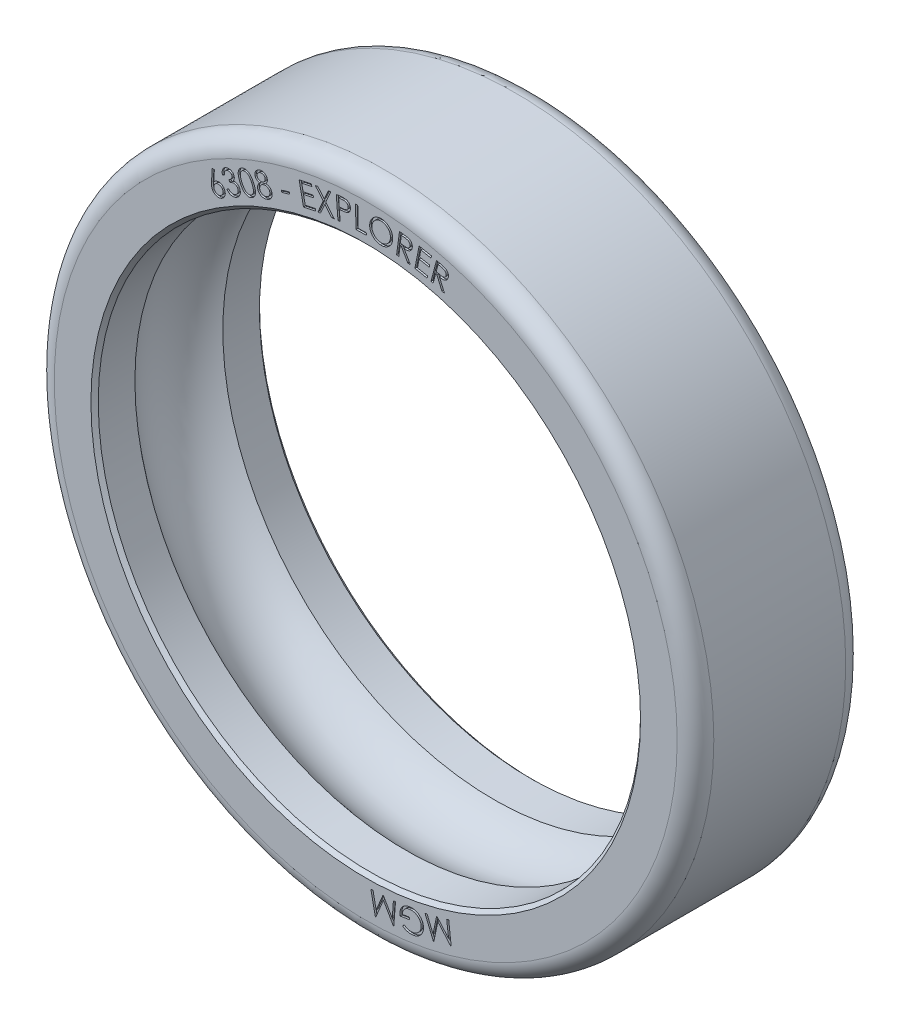
from build123d import *

# Parameters (mm, degrees)
SKETCH1_R           = 45
SKETCH1_R_2         = 37
BOSS_EXTRUDE1_DEPTH = 11.5
FILLET1_R           = 2.5
SKETCH2_R           = 7.5
CHAMFER1_SIZE       = 0.5
CUT_EXTRUDE1_DEPTH  = 0.25


with BuildPart() as part:
    # Sketch1 → Boss-Extrude1 (new, symmetric)
    with BuildSketch(Plane.XY):
        Circle(SKETCH1_R)
        Circle(SKETCH1_R_2, mode=Mode.SUBTRACT)
    extrude(amount=BOSS_EXTRUDE1_DEPTH, both=True)

    # Fillet1
    fillet1_edges = [part.edges().sort_by_distance(p)[0] for p in [
        (-45, 0, -11.5),
        (-45, 0, 11.5),
    ]]
    fillet(fillet1_edges, radius=FILLET1_R)

    # Sketch2 → Cut-Revolve1 (revolve, cut)
    with BuildSketch(Plane(origin=(0, 0, 0), x_dir=(1, 0, 0), z_dir=(0, 1, 0))):
        with Locations((32.5, 0)):
            Circle(SKETCH2_R)
    revolve(axis=Axis((0, 0, 0), (0, 0, -1)), mode=Mode.SUBTRACT)

    # Chamfer1
    chamfer1_edges = [part.edges().sort_by_distance(p)[0] for p in [
        (-37, 0, -11.5),
        (-37, 0, 11.5),
    ]]
    chamfer(chamfer1_edges, length=CHAMFER1_SIZE)

    # Sketch3 → Cut-Extrude1 (cut)
    # profile 1 of 16: a face of its own
    with BuildSketch(Plane.XY.offset(11.5)):
        with BuildLine():
            Line((-20.951800911, 35.882734801), (-20.65853168, 35.870114609))
            Line((-20.65853168, 35.870114609), (-20.724637449, 34.404970378))
            add(Edge.make_bspline(
                [(-20.724637449, 34.404970378), (-20.706102955, 34.425881102), (-20.669986854, 34.466627497), (-20.61218903, 34.521643032), (-20.552536977, 34.568713263), (-20.511103717, 34.595574515), (-20.490863411, 34.608696339)],
                knots=[0, 0, 0, 0, 1.07653288, 2.097719512, 3.070728685, 4, 4, 4, 4], degree=3))
            add(Edge.make_bspline(
                [(-20.490863411, 34.608696339), (-20.465514862, 34.623105222), (-20.415466215, 34.651554387), (-20.33631019, 34.683511799), (-20.256528008, 34.707958378), (-20.175578923, 34.723862726), (-20.093147852, 34.730233452), (-20.009552108, 34.728632328), (-19.924847206, 34.71740187), (-19.840014665, 34.698159049), (-19.756749679, 34.67169782), (-19.677310156, 34.637071504), (-19.602734472, 34.595483881), (-19.532297277, 34.547277424), (-19.467263814, 34.490991004), (-19.40723842, 34.427542669), (-19.351075325, 34.35756211), (-19.319074584, 34.306168089), (-19.302762449, 34.279970378)],
                knots=[0, 0, 0, 0, 1.017777122, 2.009518079, 2.974901327, 3.930286677, 4.885287375, 5.858403718, 6.846358588, 7.865170049, 8.89443432, 9.894366033, 10.88758779, 11.873855289, 12.871408048, 13.886293067, 14.922553973, 16, 16, 16, 16], degree=3))
            add(Edge.make_bspline(
                [(-19.302762449, 34.279970378), (-19.282284248, 34.243208173), (-19.241947782, 34.170796665), (-19.200262331, 34.054988289), (-19.17370131, 33.937268874), (-19.164523221, 33.817954108), (-19.16987247, 33.698775396), (-19.193560108, 33.58166152), (-19.231996368, 33.466989408), (-19.287675732, 33.35712467), (-19.356061588, 33.253847613), (-19.43686923, 33.159983639), (-19.529797926, 33.07756554), (-19.599419343, 33.032327636), (-19.634493218, 33.009537686)],
                knots=[0, 0, 0, 0, 1.033356258, 2.035429699, 3.014277416, 3.992815204, 4.969416816, 5.938397819, 6.921352123, 7.9347311, 8.958046688, 9.960410677, 10.972495764, 12, 12, 12, 12], degree=3))
            add(Edge.make_bspline(
                [(-19.634493218, 33.009537686), (-19.669888882, 32.990127504), (-19.73988882, 32.95174112), (-19.852546956, 32.91158828), (-19.968664127, 32.886108891), (-20.087451019, 32.876000419), (-20.206369826, 32.881012085), (-20.32296068, 32.903168657), (-20.436167715, 32.940456838), (-20.544043222, 32.994215748), (-20.644521238, 33.061404047), (-20.7361, 33.139757609), (-20.81630837, 33.229873996), (-20.860078025, 33.297196338), (-20.882089372, 33.331052109)],
                knots=[0, 0, 0, 0, 1.012093398, 2.00155808, 2.989923142, 3.989293207, 4.986028078, 5.968387595, 6.959116605, 7.968908595, 8.984282451, 9.986280779, 10.98731958, 12, 12, 12, 12], degree=3))
            add(Edge.make_bspline(
                [(-20.882089372, 33.331052109), (-20.897003194, 33.358251174), (-20.927379554, 33.413650024), (-20.964480319, 33.502999243), (-20.994276486, 33.599044652), (-21.01394337, 33.683900382), (-21.025645205, 33.756373321), (-21.032838215, 33.815512695), (-21.038188132, 33.878657376), (-21.041672133, 33.945997958), (-21.043678322, 34.017341054), (-21.042573162, 34.092678597), (-21.041097996, 34.172029028), (-21.038480462, 34.226289102), (-21.037137449, 34.254129032)],
                knots=[0, 0, 0, 0, 1.174691827, 2.392603351, 3.657683168, 4.981508639, 5.689012621, 6.43839202, 7.238268311, 8.089571598, 8.993073175, 9.941858371, 10.944002197, 12, 12, 12, 12], degree=3))
            Line((-21.037137449, 34.254129032), (-20.951800911, 35.882734801))
        make_face()
        with BuildLine():
            add(Edge.make_bspline(
                [(-20.417546103, 34.34727807), (-20.435610261, 34.335794188), (-20.471006037, 34.31329212), (-20.519594046, 34.274101068), (-20.563603441, 34.231905522), (-20.601737383, 34.184704548), (-20.635374506, 34.134541859), (-20.663944931, 34.080346817), (-20.68722476, 34.022494791), (-20.705802218, 33.961820675), (-20.718302224, 33.899598994), (-20.724955933, 33.837447666), (-20.725899834, 33.775998242), (-20.719376985, 33.715702614), (-20.708420881, 33.655848042), (-20.689119465, 33.597424484), (-20.665586585, 33.539015358), (-20.644554872, 33.502306779), (-20.633892257, 33.483696339)],
                knots=[0, 0, 0, 0, 1.036621878, 2.031206553, 3.019803421, 3.985639838, 4.965715399, 5.942805412, 6.948743677, 7.983682246, 9.013691639, 10.019301939, 11.009565719, 11.985207834, 12.954307633, 13.952156119, 14.961788315, 16, 16, 16, 16], degree=3))
            add(Edge.make_bspline(
                [(-20.633892257, 33.483696339), (-20.62240889, 33.465631367), (-20.599907832, 33.430233995), (-20.560709455, 33.38165756), (-20.518541132, 33.337605152), (-20.471370253, 33.299733335), (-20.421585429, 33.265481223), (-20.367191063, 33.237646869), (-20.3095869, 33.213844419), (-20.249020364, 33.195466578), (-20.186820672, 33.182954841), (-20.124851535, 33.176226871), (-20.063669857, 33.175640972), (-20.003384441, 33.180805535), (-19.944049943, 33.193192327), (-19.885675853, 33.211228642), (-19.828068049, 33.235355135), (-19.791363704, 33.255773681), (-19.772714372, 33.266148262)],
                knots=[0, 0, 0, 0, 1.039408692, 2.03666717, 3.027921743, 3.996354678, 4.970980731, 5.95931555, 6.958946536, 7.996667393, 9.029445824, 10.037759567, 11.020951906, 11.998296316, 12.971901028, 13.960235847, 14.963603961, 16, 16, 16, 16], degree=3))
            add(Edge.make_bspline(
                [(-19.772714372, 33.266148262), (-19.754653704, 33.27763503), (-19.719264766, 33.300142753), (-19.670627165, 33.339292795), (-19.626710275, 33.381729437), (-19.588011726, 33.428269804), (-19.554630485, 33.478683528), (-19.526628487, 33.532816938), (-19.502821591, 33.590452182), (-19.484683022, 33.651100608), (-19.471172908, 33.713137883), (-19.46469636, 33.775199702), (-19.46404424, 33.83636784), (-19.469226278, 33.896656829), (-19.4816084, 33.955990372), (-19.499645986, 34.014364722), (-19.523772135, 34.071972455), (-19.544190728, 34.10867681), (-19.554565334, 34.127326147)],
                knots=[0, 0, 0, 0, 1.039229876, 2.036316788, 3.02740083, 4.001859211, 4.97090782, 5.959072609, 6.958531621, 7.996073953, 9.030645015, 10.038785292, 11.021808485, 11.998984756, 12.972421973, 13.960586762, 14.963782259, 16, 16, 16, 16], degree=3))
            add(Edge.make_bspline(
                [(-19.554565334, 34.127326147), (-19.566039374, 34.145588858), (-19.588586626, 34.181476297), (-19.627909188, 34.230629896), (-19.671750123, 34.273694205), (-19.717860361, 34.313487051), (-19.768574127, 34.346878207), (-19.822681777, 34.375536904), (-19.88054435, 34.398855328), (-19.941307005, 34.417191029), (-20.003361368, 34.43066252), (-20.065418748, 34.4371491), (-20.126588035, 34.437798623), (-20.186876721, 34.43261727), (-20.246210346, 34.420234965), (-20.304584673, 34.402197429), (-20.362192413, 34.378071266), (-20.398896767, 34.357652675), (-20.417546103, 34.34727807)],
                knots=[0, 0, 0, 0, 1.044623428, 2.052754357, 3.041157744, 4.019307409, 4.999285662, 5.976278665, 6.982117055, 8.01695287, 9.048825166, 10.054335624, 11.034794518, 12.009421742, 12.980319666, 13.965906743, 14.966485321, 16, 16, 16, 16], degree=3))
        make_face(mode=Mode.SUBTRACT)
    # profile 2 of 16: a face of its own
    with BuildSketch(Plane.XY.offset(11.5)):
        with BuildLine():
            Line((-19.278343815, 35.937658486), (-19.548776508, 35.797634447))
            add(Edge.make_bspline(
                [(-19.548776508, 35.797634447), (-19.555951956, 35.827603943), (-19.570076178, 35.886596184), (-19.584584062, 35.97450249), (-19.59187452, 36.060101437), (-19.592616062, 36.142899103), (-19.586565051, 36.223503119), (-19.574193433, 36.301387274), (-19.55462618, 36.376754461), (-19.528965264, 36.449186562), (-19.497067751, 36.518321859), (-19.459719474, 36.583526865), (-19.416867143, 36.644479762), (-19.368791235, 36.701021334), (-19.315482501, 36.752883483), (-19.257421613, 36.800845975), (-19.193700702, 36.844078974), (-19.148146783, 36.869106368), (-19.125098623, 36.881769062)],
                knots=[0, 0, 0, 0, 1.167073876, 2.297279356, 3.371056003, 4.418228387, 5.430281861, 6.429510243, 7.401249205, 8.375650876, 9.336485471, 10.281428419, 11.218232277, 12.154851732, 13.088515766, 14.031903653, 15.004234958, 16, 16, 16, 16], degree=3))
            add(Edge.make_bspline(
                [(-19.125098623, 36.881769062), (-19.090392493, 36.898237983), (-19.021712158, 36.930828507), (-18.913253857, 36.964615197), (-18.802132011, 36.983757185), (-18.689756704, 36.989839893), (-18.578894585, 36.982267669), (-18.472454107, 36.961070766), (-18.371798502, 36.92705662), (-18.278820144, 36.878293027), (-18.193926438, 36.820266112), (-18.119736643, 36.752586169), (-18.055837297, 36.677282925), (-18.023496554, 36.620516791), (-18.007310162, 36.592105601)],
                knots=[0, 0, 0, 0, 1.078874689, 2.13499678, 3.181103719, 4.241226315, 5.291145434, 6.296083844, 7.284398724, 8.26659893, 9.238136402, 10.166908356, 11.082546055, 12, 12, 12, 12], degree=3))
            add(Edge.make_bspline(
                [(-18.007310162, 36.592105601), (-17.993864806, 36.563787787), (-17.967347656, 36.507938935), (-17.94232949, 36.419535222), (-17.929866415, 36.330297668), (-17.931489747, 36.240029187), (-17.94525059, 36.148754711), (-17.973245564, 36.056763776), (-18.012873223, 35.963344339), (-18.048432643, 35.903615247), (-18.066805354, 35.872754639)],
                knots=[0, 0, 0, 0, 0.990202168, 1.952892766, 2.892981792, 3.830911289, 4.798801723, 5.803316735, 6.865025752, 8, 8, 8, 8], degree=3))
            add(Edge.make_bspline(
                [(-18.066805354, 35.872754639), (-18.028940713, 35.875175178), (-17.954298836, 35.879946743), (-17.84367924, 35.869418456), (-17.736573743, 35.847311766), (-17.669081756, 35.821410411), (-17.635314969, 35.808451755)],
                knots=[0, 0, 0, 0, 1.031858662, 2.03408419, 3.016436452, 4, 4, 4, 4], degree=3))
            add(Edge.make_bspline(
                [(-17.635314969, 35.808451755), (-17.612257568, 35.798067622), (-17.566753665, 35.777574482), (-17.503263678, 35.739775655), (-17.443666251, 35.69885195), (-17.388784893, 35.653134496), (-17.3390549, 35.602496649), (-17.293520552, 35.547917484), (-17.252397941, 35.489141602), (-17.229283456, 35.44690357), (-17.2176467, 35.425639255)],
                knots=[0, 0, 0, 0, 1.048737756, 2.069689438, 3.061380608, 4.047094417, 5.028873506, 6.002877403, 6.994568574, 8, 8, 8, 8], degree=3))
            add(Edge.make_bspline(
                [(-17.2176467, 35.425639255), (-17.199722656, 35.387613218), (-17.164012016, 35.311852738), (-17.129921866, 35.189999715), (-17.112829172, 35.06345905), (-17.111259577, 34.95532685), (-17.11826077, 34.868287321), (-17.128105895, 34.803925055), (-17.141010397, 34.740911988), (-17.159353815, 34.679578015), (-17.181429202, 34.619463146), (-17.208139354, 34.560917863), (-17.238701663, 34.503812411), (-17.285220769, 34.430136681), (-17.352909629, 34.343841382), (-17.446559937, 34.249468489), (-17.555090951, 34.167355744), (-17.634955703, 34.122256926), (-17.675579392, 34.099317139)],
                knots=[0, 0, 0, 0, 1.289060159, 2.568235431, 3.866099929, 5.200983085, 5.879848199, 6.545317046, 7.199171734, 7.853142138, 8.50899007, 9.164145388, 9.827364724, 10.496320916, 11.837453175, 13.185759948, 14.56851976, 16, 16, 16, 16], degree=3))
            add(Edge.make_bspline(
                [(-17.675579392, 34.099317139), (-17.703813078, 34.085418191), (-17.75936487, 34.058071017), (-17.844950626, 34.02590658), (-17.929812723, 34.000775218), (-18.014573066, 33.98453154), (-18.099040883, 33.976065934), (-18.183378857, 33.975228255), (-18.267263396, 33.983340125), (-18.35044533, 33.998814288), (-18.432428036, 34.022919741), (-18.512496163, 34.055798948), (-18.591200084, 34.095868229), (-18.666837138, 34.145897998), (-18.741181981, 34.203106358), (-18.813256745, 34.269071611), (-18.883919034, 34.342873513), (-18.92739156, 34.397241468), (-18.949617854, 34.425038293)],
                knots=[0, 0, 0, 0, 1.044204042, 2.05454599, 3.031097157, 3.979315801, 4.915021349, 5.846106921, 6.774552391, 7.708460052, 8.651229051, 9.605862817, 10.578488476, 11.578269068, 12.611851249, 13.68998198, 14.818951978, 16, 16, 16, 16], degree=3))
            Line((-18.949617854, 34.425038293), (-18.690002469, 34.559653678))
            add(Edge.make_bspline(
                [(-18.690002469, 34.559653678), (-18.673353638, 34.541850377), (-18.641023391, 34.507278273), (-18.59100424, 34.459813171), (-18.541735651, 34.417308863), (-18.492504507, 34.38091301), (-18.444230178, 34.349067136), (-18.395972335, 34.323137235), (-18.348124273, 34.302454352), (-18.315705949, 34.292734553), (-18.299978431, 34.288019062)],
                knots=[0, 0, 0, 0, 1.214534055, 2.358495011, 3.434852755, 4.455164912, 5.407730665, 6.314463808, 7.182274135, 8, 8, 8, 8], degree=3))
            add(Edge.make_bspline(
                [(-18.299978431, 34.288019062), (-18.280018237, 34.283573044), (-18.24019308, 34.274702219), (-18.179114527, 34.269266456), (-18.117743571, 34.268141701), (-18.055966937, 34.274580039), (-17.993792771, 34.286567604), (-17.931279187, 34.305064699), (-17.867757851, 34.327983362), (-17.826834194, 34.348487764), (-17.805988046, 34.358932524)],
                knots=[0, 0, 0, 0, 0.960450041, 1.916317779, 2.87699867, 3.842239016, 4.830409882, 5.849817305, 6.904715992, 8, 8, 8, 8], degree=3))
            add(Edge.make_bspline(
                [(-17.805988046, 34.358932524), (-17.782715238, 34.371553077), (-17.737257319, 34.396204338), (-17.674492139, 34.439116278), (-17.61827315, 34.485885471), (-17.567426908, 34.535308093), (-17.523979495, 34.589502247), (-17.486521704, 34.646558758), (-17.455541811, 34.707429948), (-17.431176521, 34.771152902), (-17.413608534, 34.836296242), (-17.400871494, 34.900910252), (-17.396421623, 34.964836495), (-17.397559677, 35.027584187), (-17.404453515, 35.089564594), (-17.419396775, 35.150198674), (-17.43957658, 35.210410099), (-17.458197635, 35.24873815), (-17.4676467, 35.268187332)],
                knots=[0, 0, 0, 0, 1.17234138, 2.289891198, 3.361423708, 4.409434219, 5.425390201, 6.432156755, 7.428385078, 8.445309652, 9.448628097, 10.414672812, 11.358072222, 12.281217409, 13.192685437, 14.113994452, 15.042965565, 16, 16, 16, 16], degree=3))
            add(Edge.make_bspline(
                [(-17.4676467, 35.268187332), (-17.481949106, 35.29310922), (-17.510432406, 35.342741265), (-17.566099811, 35.408647667), (-17.631235403, 35.466267868), (-17.704833767, 35.515211147), (-17.784595044, 35.554104087), (-17.86900557, 35.581118249), (-17.956450096, 35.595241484), (-18.031878855, 35.597660456), (-18.094882394, 35.591915428), (-18.146849898, 35.583284104), (-18.202903699, 35.5704248), (-18.263554146, 35.554529298), (-18.327507261, 35.532188889), (-18.396330031, 35.507017313), (-18.469370665, 35.47775237), (-18.519000642, 35.455654027), (-18.544569777, 35.444269062)],
                knots=[0, 0, 0, 0, 1.124407651, 2.239262571, 3.362710373, 4.523375892, 5.692719404, 6.829965073, 7.983919023, 9.154211079, 9.77690822, 10.461024065, 11.217256548, 12.030519844, 12.916902949, 13.870785113, 14.903038321, 16, 16, 16, 16], degree=3))
            Line((-18.544569777, 35.444269062), (-18.6707717, 35.687658486))
            add(Edge.make_bspline(
                [(-18.6707717, 35.687658486), (-18.641324847, 35.703639314), (-18.583460257, 35.735042467), (-18.50506928, 35.792310085), (-18.433515654, 35.853734607), (-18.37205265, 35.921166001), (-18.319591163, 35.990326459), (-18.280239788, 36.06067749), (-18.252128761, 36.129598812), (-18.23772535, 36.197984102), (-18.233832205, 36.2647269), (-18.240927002, 36.329413339), (-18.255879476, 36.392500848), (-18.274412312, 36.431317079), (-18.283752469, 36.450879639)],
                knots=[0, 0, 0, 0, 1.265022529, 2.48583467, 3.661091174, 4.823891549, 5.927839059, 6.934633096, 7.862608886, 8.729878519, 9.563991744, 10.378422005, 11.182758927, 12, 12, 12, 12], degree=3))
            add(Edge.make_bspline(
                [(-18.283752469, 36.450879639), (-18.291428927, 36.464912109), (-18.306670614, 36.492773724), (-18.335165507, 36.530392492), (-18.366885785, 36.564487506), (-18.401591178, 36.59535561), (-18.440530607, 36.621852425), (-18.482689992, 36.644620971), (-18.528301359, 36.664088806), (-18.576968875, 36.679529947), (-18.627724591, 36.690181674), (-18.679012467, 36.696239845), (-18.730543426, 36.697604254), (-18.782505316, 36.693291986), (-18.834571635, 36.683567625), (-18.88689347, 36.668997492), (-18.939279985, 36.649028358), (-18.973573589, 36.63243121), (-18.9910842, 36.623956562)],
                knots=[0, 0, 0, 0, 0.946275204, 1.87883935, 2.785534277, 3.701881327, 4.623360298, 5.568370179, 6.53582998, 7.556465367, 8.587324861, 9.602774938, 10.611548924, 11.635282892, 12.684817914, 13.744165319, 14.848151286, 16, 16, 16, 16], degree=3))
            add(Edge.make_bspline(
                [(-18.9910842, 36.623956562), (-19.018062876, 36.608546837), (-19.070870934, 36.578383842), (-19.13981506, 36.519931308), (-19.195520239, 36.451583032), (-19.232430619, 36.387876179), (-19.254570704, 36.331940324), (-19.268475928, 36.286163252), (-19.278617666, 36.236669429), (-19.284924647, 36.183599116), (-19.288702411, 36.127220106), (-19.288289924, 36.067232909), (-19.285588286, 36.00362594), (-19.280805456, 35.96007395), (-19.278343815, 35.937658486)],
                knots=[0, 0, 0, 0, 1.394941085, 2.730457528, 4.035961984, 5.343081165, 6.022148811, 6.73735053, 7.49163979, 8.290434845, 9.138827248, 10.030532242, 10.986348654, 12, 12, 12, 12], degree=3))
        make_face()
    # profile 3 of 16: a face of its own
    with BuildSketch(Plane.XY.offset(11.5)):
        with BuildLine():
            add(Edge.make_bspline(
                [(-17.147841239, 36.127404493), (-17.166988103, 36.17134455), (-17.204177499, 36.256690334), (-17.253129945, 36.383165861), (-17.296544443, 36.503062948), (-17.330740006, 36.617521336), (-17.360710183, 36.725166419), (-17.381251417, 36.827286584), (-17.396424351, 36.923279256), (-17.403461369, 37.013890507), (-17.404889878, 37.099818219), (-17.40025951, 37.182045777), (-17.392466526, 37.261248936), (-17.378395773, 37.337107839), (-17.359881019, 37.409931217), (-17.335661318, 37.479256959), (-17.307597463, 37.546063132), (-17.273691764, 37.608886452), (-17.236098362, 37.668629185), (-17.19355809, 37.723695205), (-17.148717853, 37.776001369), (-17.099185756, 37.823139168), (-17.046719342, 37.867011145), (-16.990020755, 37.905911731), (-16.929713926, 37.941025999), (-16.887380354, 37.96104128), (-16.865990277, 37.971154493)],
                knots=[0, 0, 0, 0, 1.644348256, 3.193855411, 4.652545985, 6.017945411, 7.291715144, 8.484666383, 9.589885103, 10.624159414, 11.600251026, 12.536243989, 13.448595334, 14.328928942, 15.180790282, 16.024152164, 16.846326292, 17.664237437, 18.470777853, 19.265339134, 20.049637543, 20.832247601, 21.608432778, 22.393934931, 23.188496212, 24, 24, 24, 24], degree=3))
            add(Edge.make_bspline(
                [(-16.865990277, 37.971154493), (-16.843909856, 37.980588508), (-16.800197612, 37.999264873), (-16.732349413, 38.01974164), (-16.664476723, 38.036540737), (-16.595635682, 38.046536382), (-16.526339336, 38.051342211), (-16.4565636, 38.051015948), (-16.386352537, 38.043775543), (-16.315690473, 38.032924659), (-16.245008981, 38.015124053), (-16.174787713, 37.991873353), (-16.105407431, 37.962024094), (-16.036596288, 37.926787346), (-15.969441406, 37.883886701), (-15.901702217, 37.836902904), (-15.835981918, 37.782210467), (-15.769889672, 37.72259403), (-15.704449168, 37.655663876), (-15.641243679, 37.579498698), (-15.578068726, 37.49601702), (-15.515938651, 37.404239088), (-15.455437765, 37.30379805), (-15.396319466, 37.194818398), (-15.336994232, 37.078254527), (-15.300157379, 36.996751482), (-15.2812547, 36.954928531)],
                knots=[0, 0, 0, 0, 0.817373043, 1.618139914, 2.41098732, 3.197554239, 3.984239562, 4.77588192, 5.571046098, 6.386679532, 7.209277637, 8.050904336, 8.903962822, 9.779942374, 10.68126015, 11.616580745, 12.586488836, 13.591346542, 14.648224302, 15.771886253, 16.96067757, 18.21368486, 19.545550404, 20.953431285, 22.436665865, 24, 24, 24, 24], degree=3))
            add(Edge.make_bspline(
                [(-15.2812547, 36.954928531), (-15.263139742, 36.912979972), (-15.227826748, 36.83120616), (-15.180985404, 36.709705327), (-15.140587473, 36.593080378), (-15.106584746, 36.481339944), (-15.08011043, 36.374175638), (-15.060147582, 36.271902985), (-15.046403702, 36.174427659), (-15.040762224, 36.081418392), (-15.039857386, 35.992723715), (-15.044797898, 35.907633733), (-15.054316807, 35.825943183), (-15.068478351, 35.747515675), (-15.088578777, 35.672689741), (-15.11311254, 35.601136114), (-15.14245841, 35.532803824), (-15.177597815, 35.46858686), (-15.216555382, 35.407928572), (-15.259278657, 35.351205327), (-15.305910615, 35.298786819), (-15.35551015, 35.249899087), (-15.409669513, 35.205817389), (-15.467017219, 35.165683553), (-15.528361249, 35.129761536), (-15.571354889, 35.109455147), (-15.593153739, 35.0991593)],
                knots=[0, 0, 0, 0, 1.557582403, 3.036324846, 4.437949218, 5.764477754, 7.016639808, 8.199252882, 9.315717374, 10.369609342, 11.373506136, 12.337953886, 13.273112936, 14.175894542, 15.052173839, 15.911715019, 16.752828269, 17.583985515, 18.404213623, 19.208682928, 20.0020906, 20.794086305, 21.580171511, 22.379639729, 23.178436824, 24, 24, 24, 24], degree=3))
            add(Edge.make_bspline(
                [(-15.593153739, 35.0991593), (-15.614829657, 35.089911305), (-15.657913137, 35.071529808), (-15.7248238, 35.051830678), (-15.791541894, 35.035771859), (-15.85887696, 35.025566113), (-15.926608768, 35.020521123), (-15.994923105, 35.022162426), (-16.063634827, 35.027995016), (-16.132811136, 35.039396506), (-16.201824555, 35.056705648), (-16.269949721, 35.080570277), (-16.337453585, 35.10922411), (-16.403818396, 35.14447057), (-16.469418846, 35.185514844), (-16.534397999, 35.232342237), (-16.597934131, 35.285691932), (-16.661831621, 35.344149256), (-16.724548655, 35.410759042), (-16.78665391, 35.486191537), (-16.847381926, 35.571262017), (-16.909178039, 35.66449435), (-16.969216776, 35.767492849), (-17.03032214, 35.878817683), (-17.090249877, 35.999608057), (-17.128284571, 36.084007837), (-17.147841239, 36.127404493)],
                knots=[0, 0, 0, 0, 0.808708688, 1.607405303, 2.391749683, 3.164328459, 3.943708585, 4.721264601, 5.508590546, 6.310510527, 7.126473659, 7.948908205, 8.787246315, 9.642797802, 10.526677165, 11.443235139, 12.391071431, 13.37454326, 14.416032139, 15.53037154, 16.727660613, 18.004238844, 19.370597442, 20.820717087, 22.365277168, 24, 24, 24, 24], degree=3))
        make_face()
        with BuildLine():
            add(Edge.make_bspline(
                [(-16.887023931, 36.236779493), (-16.870208785, 36.199420504), (-16.837654493, 36.127093124), (-16.786887012, 36.023623349), (-16.737453927, 35.927866418), (-16.687452567, 35.84094015), (-16.638747076, 35.76184788), (-16.591030021, 35.690603966), (-16.542886194, 35.62829946), (-16.495722849, 35.573123187), (-16.447406284, 35.525493235), (-16.399521855, 35.481825931), (-16.350118374, 35.443229866), (-16.299743514, 35.409742209), (-16.248792537, 35.380528743), (-16.197091809, 35.355697922), (-16.144174015, 35.335850489), (-16.073718556, 35.316285333), (-15.986470221, 35.301354643), (-15.883948597, 35.301027766), (-15.785053179, 35.314869994), (-15.724023245, 35.338532374), (-15.693514316, 35.350361223)],
                knots=[0, 0, 0, 0, 1.479117772, 2.863586916, 4.160859019, 5.36927535, 6.483265112, 7.514387322, 8.46339926, 9.324799344, 10.13286684, 10.911324189, 11.663672896, 12.393861846, 13.093612757, 13.782703977, 14.46247033, 15.131102076, 16.421237091, 17.643599135, 18.822032672, 20, 20, 20, 20], degree=3))
            add(Edge.make_bspline(
                [(-15.693514316, 35.350361223), (-15.664036493, 35.365163216), (-15.60543648, 35.394588623), (-15.528169153, 35.457413418), (-15.46012256, 35.53255874), (-15.413190009, 35.605872958), (-15.381346473, 35.670148474), (-15.360929186, 35.721775894), (-15.344617756, 35.776247932), (-15.332668171, 35.833354052), (-15.325082322, 35.893049678), (-15.32075599, 35.955249667), (-15.320725236, 36.020315914), (-15.324032981, 36.064517902), (-15.325725854, 36.08714007)],
                knots=[0, 0, 0, 0, 1.34371956, 2.671227853, 4.038231018, 5.470134242, 6.209200717, 6.965764694, 7.734483616, 8.528724964, 9.345607088, 10.190204354, 11.073763381, 12, 12, 12, 12], degree=3))
            add(Edge.make_bspline(
                [(-15.325725854, 36.08714007), (-15.328693202, 36.115613559), (-15.33472969, 36.17353729), (-15.348460709, 36.261491483), (-15.36823515, 36.351527005), (-15.391209854, 36.444184869), (-15.420610477, 36.538815365), (-15.454238609, 36.635754246), (-15.491889904, 36.735432615), (-15.520748573, 36.80160227), (-15.535461431, 36.835337185)],
                knots=[0, 0, 0, 0, 0.880166561, 1.790526255, 2.735223354, 3.713712156, 4.724920285, 5.780674665, 6.868533468, 8, 8, 8, 8], degree=3))
            add(Edge.make_bspline(
                [(-15.535461431, 36.835337185), (-15.550652803, 36.868901146), (-15.580252141, 36.9342982), (-15.627532147, 37.028310425), (-15.674785178, 37.116621674), (-15.722754782, 37.199226393), (-15.77218009, 37.275768465), (-15.822360959, 37.346316886), (-15.873092717, 37.411272328), (-15.924579056, 37.469951668), (-15.97668227, 37.523150917), (-16.028559894, 37.571484768), (-16.081591385, 37.613325648), (-16.134253857, 37.650398488), (-16.18690649, 37.682687625), (-16.240778326, 37.708168383), (-16.294107376, 37.729853969), (-16.364864514, 37.748997735), (-16.451416091, 37.764193463), (-16.553162822, 37.764429319), (-16.651099064, 37.750721476), (-16.71148741, 37.726980065), (-16.741591239, 37.715144877)],
                knots=[0, 0, 0, 0, 1.331057879, 2.593474156, 3.801386947, 4.949688523, 6.043883181, 7.092280068, 8.076897511, 9.020626816, 9.911233434, 10.766705119, 11.580594203, 12.34967143, 13.093222751, 13.808657883, 14.500869014, 15.169989652, 16.453926756, 17.662706678, 18.834850031, 20, 20, 20, 20], degree=3))
            add(Edge.make_bspline(
                [(-16.741591239, 37.715144877), (-16.771094676, 37.700376236), (-16.829857753, 37.670960992), (-16.90693344, 37.607426904), (-16.975197949, 37.531516854), (-17.02226286, 37.457298221), (-17.054921356, 37.392636664), (-17.075505487, 37.340558977), (-17.091504979, 37.285754167), (-17.104056812, 37.228524905), (-17.113423212, 37.168957802), (-17.117174429, 37.106626282), (-17.117700456, 37.041846237), (-17.115036092, 36.973743364), (-17.106102178, 36.901518405), (-17.092254485, 36.823841863), (-17.072293146, 36.740402902), (-17.045925534, 36.651192649), (-17.014850381, 36.555929989), (-16.977838853, 36.454570072), (-16.935447149, 36.347229436), (-16.903490523, 36.274338627), (-16.887023931, 36.236779493)],
                knots=[0, 0, 0, 0, 1.188812893, 2.36780218, 3.582595501, 4.865513908, 5.529082069, 6.198427844, 6.885463182, 7.589669522, 8.314406683, 9.061637094, 9.843371185, 10.654831049, 11.52208948, 12.470511935, 13.504553944, 14.62007023, 15.830889533, 17.124543506, 18.51833643, 20, 20, 20, 20], degree=3))
        make_face(mode=Mode.SUBTRACT)
    # profile 4 of 16: a face of its own
    with BuildSketch(Plane.XY.offset(11.5)):
        with BuildLine():
            add(Edge.make_bspline(
                [(-13.633680517, 37.731905028), (-13.606600021, 37.728762168), (-13.55367085, 37.722619409), (-13.476692979, 37.709200803), (-13.403894202, 37.693448734), (-13.336076915, 37.673253796), (-13.272543677, 37.651431587), (-13.213855788, 37.62545481), (-13.159905636, 37.595815679), (-13.093421407, 37.553896858), (-13.019714825, 37.491861302), (-12.942765258, 37.406347373), (-12.879371941, 37.308072742), (-12.849150732, 37.235641551), (-12.83380071, 37.198852143)],
                knots=[0, 0, 0, 0, 0.961956118, 1.880155356, 2.756635466, 3.588888544, 4.375954047, 5.126082698, 5.850552789, 6.546772351, 7.897320012, 9.234179211, 10.595178314, 12, 12, 12, 12], degree=3))
            add(Edge.make_bspline(
                [(-12.83380071, 37.198852143), (-12.824514933, 37.172153578), (-12.806094691, 37.119191501), (-12.787025672, 37.03808061), (-12.775557521, 36.956816487), (-12.77111791, 36.875548058), (-12.774998741, 36.794086886), (-12.785730438, 36.712600036), (-12.80437894, 36.631131539), (-12.822323235, 36.57792153), (-12.831396863, 36.551015605)],
                knots=[0, 0, 0, 0, 1.024038568, 2.031390387, 3.014052611, 3.995560736, 4.976719679, 5.965585438, 6.971287426, 8, 8, 8, 8], degree=3))
            add(Edge.make_bspline(
                [(-12.831396863, 36.551015605), (-12.844458459, 36.518610869), (-12.870416262, 36.45421171), (-12.92275462, 36.364092709), (-12.98591801, 36.281323786), (-13.059000704, 36.20493448), (-13.143378207, 36.136403991), (-13.237821024, 36.074310837), (-13.342564486, 36.018659121), (-13.417816019, 35.988800061), (-13.456396863, 35.973491566)],
                knots=[0, 0, 0, 0, 0.952424658, 1.892789624, 2.832963937, 3.78783232, 4.770458009, 5.792256171, 6.868107852, 8, 8, 8, 8], degree=3))
            add(Edge.make_bspline(
                [(-13.456396863, 35.973491566), (-13.494059056, 35.960244164), (-13.567347067, 35.93446564), (-13.677555939, 35.907251815), (-13.784023878, 35.891635355), (-13.886702303, 35.88546197), (-13.985630462, 35.89184669), (-14.080808012, 35.907576361), (-14.171764603, 35.935685538), (-14.257816821, 35.974303875), (-14.338134257, 36.020499279), (-14.412465342, 36.07115233), (-14.48052664, 36.125912938), (-14.540905258, 36.186072911), (-14.595157563, 36.250207061), (-14.64186895, 36.319062538), (-14.68301141, 36.391921278), (-14.703762262, 36.44377821), (-14.714209363, 36.469885797)],
                knots=[0, 0, 0, 0, 1.265013519, 2.461628436, 3.591307801, 4.672271976, 5.715560252, 6.727100841, 7.723339428, 8.723939355, 9.710784817, 10.656552204, 11.572872112, 12.475359314, 13.354216619, 14.231305898, 15.109543651, 16, 16, 16, 16], degree=3))
            add(Edge.make_bspline(
                [(-14.714209363, 36.469885797), (-14.727067694, 36.50843338), (-14.752373217, 36.584296002), (-14.768580509, 36.702526478), (-14.768290463, 36.820339574), (-14.75271926, 36.918228779), (-14.730356434, 36.99608688), (-14.708106988, 37.055887036), (-14.67948879, 37.115912405), (-14.645867519, 37.176922947), (-14.605671944, 37.238100583), (-14.56095705, 37.300742353), (-14.509357595, 37.363219823), (-14.472375921, 37.404317766), (-14.453392056, 37.425414643)],
                knots=[0, 0, 0, 0, 1.389852079, 2.735264191, 4.066895974, 5.415403665, 6.114992103, 6.840435011, 7.5988671, 8.391561388, 9.225472635, 10.10559036, 11.027539484, 12, 12, 12, 12], degree=3))
            add(Edge.make_bspline(
                [(-14.453392056, 37.425414643), (-14.492662216, 37.431235876), (-14.568588282, 37.442490817), (-14.675848117, 37.475068521), (-14.773258463, 37.517446228), (-14.859313185, 37.571873288), (-14.934776813, 37.635261622), (-14.997784407, 37.707422115), (-15.051410947, 37.786163347), (-15.075743243, 37.844386007), (-15.08800744, 37.873731951)],
                knots=[0, 0, 0, 0, 1.162502521, 2.247616059, 3.275650377, 4.267970037, 5.222229189, 6.15427175, 7.069698364, 8, 8, 8, 8], degree=3))
            add(Edge.make_bspline(
                [(-15.08800744, 37.873731951), (-15.098068392, 37.904533939), (-15.118250365, 37.966321824), (-15.129715886, 38.064713431), (-15.129378644, 38.166503401), (-15.114170356, 38.27105596), (-15.084858931, 38.374870434), (-15.042063147, 38.475280604), (-14.984062342, 38.569406616), (-14.913806311, 38.657541852), (-14.832433522, 38.737850651), (-14.74118321, 38.807805418), (-14.64133508, 38.867018124), (-14.569588067, 38.896625828), (-14.53331994, 38.911592528)],
                knots=[0, 0, 0, 0, 0.893415864, 1.792166009, 2.722131367, 3.700662858, 4.701286788, 5.695598054, 6.706640354, 7.746620013, 8.803463017, 9.857475438, 10.916953495, 12, 12, 12, 12], degree=3))
            add(Edge.make_bspline(
                [(-14.53331994, 38.911592528), (-14.497127253, 38.92379915), (-14.425624519, 38.94791471), (-14.314473975, 38.966593988), (-14.20312494, 38.972194297), (-14.092208047, 38.963932239), (-13.984395124, 38.941420463), (-13.881361338, 38.907664168), (-13.785511035, 38.859411135), (-13.69771329, 38.799473155), (-13.618793604, 38.730083344), (-13.551902183, 38.652114212), (-13.496244721, 38.567362182), (-13.470493509, 38.505613614), (-13.457598786, 38.474693489)],
                knots=[0, 0, 0, 0, 1.066796738, 2.10757721, 3.139636158, 4.17902852, 5.208529773, 6.21303341, 7.202679408, 8.198711101, 9.178988741, 10.132403902, 11.064815494, 12, 12, 12, 12], degree=3))
            add(Edge.make_bspline(
                [(-13.457598786, 38.474693489), (-13.447204289, 38.443494611), (-13.426745637, 38.382088373), (-13.41330824, 38.286847523), (-13.413707424, 38.192254518), (-13.429034454, 38.098216773), (-13.459133586, 38.004927019), (-13.503199904, 37.912209583), (-13.561104175, 37.819649306), (-13.608933139, 37.76182443), (-13.633680517, 37.731905028)],
                knots=[0, 0, 0, 0, 0.978739865, 1.92637479, 2.852076742, 3.789722741, 4.754866681, 5.764724669, 6.84343715, 8, 8, 8, 8], degree=3))
        make_face()
        with BuildLine():
            add(Edge.make_bspline(
                [(-14.444978594, 38.634549258), (-14.463532357, 38.627229642), (-14.500092499, 38.612806357), (-14.551790853, 38.586552311), (-14.598674463, 38.555940656), (-14.642719832, 38.523585839), (-14.682147772, 38.48704145), (-14.717376654, 38.446813896), (-14.748634251, 38.403592371), (-14.775555732, 38.357481373), (-14.797577221, 38.309933407), (-14.814462034, 38.262004921), (-14.827046015, 38.214455458), (-14.832663327, 38.16656674), (-14.834182888, 38.118840262), (-14.829763781, 38.071082061), (-14.820405552, 38.023408522), (-14.809732804, 37.992616788), (-14.804353594, 37.977097335)],
                knots=[0, 0, 0, 0, 1.147048059, 2.260255192, 3.327916416, 4.365041468, 5.400693012, 6.413198219, 7.43666103, 8.46439665, 9.480110036, 10.445964697, 11.385050674, 12.302680438, 13.213337452, 14.127269567, 15.056118419, 16, 16, 16, 16], degree=3))
            add(Edge.make_bspline(
                [(-14.804353594, 37.977097335), (-14.798054046, 37.961929376), (-14.785556158, 37.931837145), (-14.761427795, 37.889471618), (-14.731993696, 37.850651251), (-14.698309212, 37.814433907), (-14.659546943, 37.78126651), (-14.616104959, 37.751342254), (-14.568293662, 37.724106283), (-14.516584367, 37.700494649), (-14.462596158, 37.680676884), (-14.407789112, 37.666527025), (-14.353218222, 37.656190768), (-14.298592112, 37.653174739), (-14.243815412, 37.653832502), (-14.189378099, 37.661584715), (-14.134714164, 37.673238364), (-14.099318485, 37.685455033), (-14.081396863, 37.691640605)],
                knots=[0, 0, 0, 0, 0.919737345, 1.824698276, 2.722670988, 3.643913969, 4.591118234, 5.575054188, 6.595572619, 7.670388659, 8.756921725, 9.813292736, 10.839351816, 11.86301363, 12.873482337, 13.903769069, 14.938631486, 16, 16, 16, 16], degree=3))
            add(Edge.make_bspline(
                [(-14.081396863, 37.691640605), (-14.058887221, 37.701095731), (-14.014307352, 37.71982141), (-13.952218833, 37.757844308), (-13.895497848, 37.80374473), (-13.844632868, 37.857256549), (-13.800591237, 37.916111134), (-13.764196084, 37.979180288), (-13.738594524, 38.046686722), (-13.72126902, 38.116311882), (-13.712796284, 38.186389591), (-13.713242471, 38.254460463), (-13.722531993, 38.319739205), (-13.735852396, 38.360660934), (-13.742454556, 38.380943489)],
                knots=[0, 0, 0, 0, 1.03378628, 2.047391792, 3.073863165, 4.118922591, 5.168491723, 6.183838674, 7.19466591, 8.218253042, 9.218863304, 10.17845716, 11.097165628, 12, 12, 12, 12], degree=3))
            add(Edge.make_bspline(
                [(-13.742454556, 38.380943489), (-13.74818701, 38.394696971), (-13.759583014, 38.422038615), (-13.781542775, 38.460597883), (-13.807018042, 38.497235152), (-13.836731886, 38.531243764), (-13.87115566, 38.561955121), (-13.90840559, 38.591141592), (-13.950175987, 38.617478027), (-13.995383489, 38.64143194), (-14.043700603, 38.66144363), (-14.094826988, 38.675195613), (-14.1479822, 38.683717995), (-14.203454932, 38.686209081), (-14.260995126, 38.681490206), (-14.320621306, 38.671673772), (-14.382794698, 38.657060972), (-14.423876398, 38.642188642), (-14.444978594, 38.634549258)],
                knots=[0, 0, 0, 0, 0.856808698, 1.703318465, 2.54762746, 3.421711491, 4.294882798, 5.198790238, 6.142193082, 7.132266694, 8.140562009, 9.144564578, 10.171793604, 11.233379055, 12.331515788, 13.487604755, 14.709472615, 16, 16, 16, 16], degree=3))
        make_face(mode=Mode.SUBTRACT)
        with BuildLine():
            add(Edge.make_bspline(
                [(-13.983440133, 37.441640605), (-14.00687625, 37.432265479), (-14.052875754, 37.413864344), (-14.117515919, 37.379114167), (-14.177045541, 37.340117465), (-14.231919916, 37.296588874), (-14.280957671, 37.247600807), (-14.326104443, 37.194599852), (-14.364964299, 37.136082648), (-14.398271918, 37.07370653), (-14.426465087, 37.009736775), (-14.447486116, 36.945055704), (-14.46240151, 36.880958981), (-14.46947011, 36.816832469), (-14.470112972, 36.753003002), (-14.464194406, 36.689499659), (-14.450873497, 36.626432102), (-14.436987884, 36.585546871), (-14.429954556, 36.56483772)],
                knots=[0, 0, 0, 0, 1.107891442, 2.174526407, 3.21649256, 4.230523318, 5.244592241, 6.256177337, 7.283479824, 8.322693679, 9.358961203, 10.349436266, 11.305635549, 12.244186438, 13.176821815, 14.104797729, 15.040043852, 16, 16, 16, 16], degree=3))
            add(Edge.make_bspline(
                [(-14.429954556, 36.56483772), (-14.419439802, 36.539846556), (-14.398607883, 36.490333847), (-14.3547658, 36.422007437), (-14.301470727, 36.359893265), (-14.239334345, 36.304051444), (-14.16895951, 36.257422724), (-14.092940308, 36.220224211), (-14.011227281, 36.194975569), (-13.924926963, 36.180489047), (-13.834652151, 36.177952247), (-13.741430007, 36.18568427), (-13.645822322, 36.205731465), (-13.582990899, 36.227397361), (-13.550747825, 36.238515605)],
                knots=[0, 0, 0, 0, 0.929405196, 1.841345572, 2.772986996, 3.73243725, 4.699448533, 5.662146499, 6.627860913, 7.625017265, 8.657131239, 9.719946742, 10.829949679, 12, 12, 12, 12], degree=3))
            add(Edge.make_bspline(
                [(-13.550747825, 36.238515605), (-13.526122059, 36.24831256), (-13.478007283, 36.26745423), (-13.410506078, 36.302608704), (-13.348787052, 36.341602676), (-13.29347163, 36.385130259), (-13.243327569, 36.431913627), (-13.200949987, 36.484293424), (-13.162901604, 36.539754402), (-13.132352325, 36.599651984), (-13.10722168, 36.660977493), (-13.088249091, 36.722701557), (-13.076272166, 36.784365705), (-13.070228571, 36.845734051), (-13.070030359, 36.906967838), (-13.07681831, 36.967994483), (-13.089924155, 37.028837583), (-13.103434898, 37.068359807), (-13.110243017, 37.08827522)],
                knots=[0, 0, 0, 0, 1.188783776, 2.322691835, 3.410061896, 4.460340596, 5.477785054, 6.480385441, 7.477772652, 8.491077903, 9.491095305, 10.449512885, 11.383976377, 12.305374679, 13.213386337, 14.126767348, 15.056070295, 16, 16, 16, 16], degree=3))
            add(Edge.make_bspline(
                [(-13.110243017, 37.08827522), (-13.118036648, 37.107304942), (-13.133522091, 37.145115777), (-13.163976427, 37.197893272), (-13.199004888, 37.247366201), (-13.240057897, 37.29222162), (-13.286236121, 37.333662524), (-13.337943862, 37.37070773), (-13.394988453, 37.403850967), (-13.456180742, 37.433125036), (-13.520454353, 37.456637204), (-13.585403711, 37.47530119), (-13.651164811, 37.485777382), (-13.717144797, 37.491096465), (-13.783559188, 37.488142085), (-13.850254427, 37.480049677), (-13.917153526, 37.464101341), (-13.961114391, 37.44920552), (-13.983440133, 37.441640605)],
                knots=[0, 0, 0, 0, 0.945596275, 1.878838973, 2.79743608, 3.730906504, 4.671228262, 5.648787245, 6.652987827, 7.704703786, 8.766636677, 9.800168324, 10.80973076, 11.826677062, 12.841614909, 13.864064118, 14.915254491, 16, 16, 16, 16], degree=3))
        make_face(mode=Mode.SUBTRACT)
    # profile 5 of 16: a face of its own
    with BuildSketch(Plane.XY.offset(11.5)):
        Polygon((-11.512517041, 38.041284362), (-10.43799781, 38.349577631), (-10.369488195, 38.1109959), (-11.444007425, 37.802702631), align=None)
    # profile 6 of 16: a face of its own
    with BuildSketch(Plane.XY.offset(11.5)):
        Polygon((-9.089403516, 40.47176465), (-7.410917939, 40.816716573), (-7.351422747, 40.527654073), (-8.737240054, 40.242798303), (-8.549139093, 39.32753388), (-7.175341016, 39.609985803), (-7.116446785, 39.32332715), (-8.490244862, 39.040875227), (-8.254667939, 37.891836765), (-6.880869862, 38.174288688), (-6.82137467, 37.88582715), (-8.487841016, 37.543279073), align=None)
    # profile 7 of 16: a face of its own
    with BuildSketch(Plane.XY.offset(11.5)):
        Polygon((-6.880313664, 40.904068181), (-6.534760779, 40.953347027), (-5.663366549, 39.900462412), (-5.114087703, 41.155270104), (-4.772741549, 41.203947988), (-5.448823279, 39.646255681), (-4.293775203, 38.256231642), (-4.639328087, 38.206952796), (-5.583438664, 39.337962412), (-6.178390587, 37.988202796), (-6.523943472, 37.93892395), (-5.798582895, 39.596375873), align=None)
    # profile 8 of 16: a face of its own
    with BuildSketch(Plane.XY.offset(11.5)):
        with BuildLine():
            Line((-4.017027858, 41.287243527), (-3.422676896, 41.332916604))
            add(Edge.make_bspline(
                [(-3.422676896, 41.332916604), (-3.381820142, 41.336037628), (-3.303547633, 41.342016821), (-3.191154434, 41.348756856), (-3.089166563, 41.35268065), (-2.997411154, 41.355843906), (-2.91605966, 41.354586997), (-2.844671627, 41.353581076), (-2.783681258, 41.348916373), (-2.746575598, 41.343695093), (-2.729768243, 41.341330065)],
                knots=[0, 0, 0, 0, 1.416626325, 2.713942893, 3.892284094, 4.945332161, 5.887232446, 6.704711434, 7.413286943, 8, 8, 8, 8], degree=3))
            add(Edge.make_bspline(
                [(-2.729768243, 41.341330065), (-2.708463914, 41.337237703), (-2.666291443, 41.329136767), (-2.604984413, 41.311639284), (-2.546259573, 41.289652514), (-2.489740126, 41.264397446), (-2.436563886, 41.232942229), (-2.385447301, 41.198425132), (-2.337003197, 41.158987256), (-2.291719446, 41.115263989), (-2.249354625, 41.068207661), (-2.21271881, 41.016450402), (-2.180060117, 40.961734569), (-2.152343566, 40.903428748), (-2.130185764, 40.841298372), (-2.112012887, 40.776110247), (-2.099534589, 40.707056273), (-2.094643944, 40.659878132), (-2.09214805, 40.635801219)],
                knots=[0, 0, 0, 0, 1.009502279, 1.998335907, 2.963134883, 3.927032177, 4.875469738, 5.835027167, 6.796214341, 7.778873212, 8.763123578, 9.738722294, 10.725443215, 11.726512105, 12.738294387, 13.792501434, 14.873424181, 16, 16, 16, 16], degree=3))
            add(Edge.make_bspline(
                [(-2.09214805, 40.635801219), (-2.090812043, 40.611370891), (-2.088206374, 40.563723451), (-2.089989272, 40.493391224), (-2.097115529, 40.425839954), (-2.109725266, 40.361129895), (-2.127204968, 40.299132243), (-2.149993299, 40.240097533), (-2.178450732, 40.184102896), (-2.211596357, 40.130977773), (-2.249312993, 40.081379499), (-2.29129898, 40.035087781), (-2.337358617, 39.992660676), (-2.387658418, 39.953884177), (-2.441895415, 39.919212848), (-2.49986052, 39.887448795), (-2.562543345, 39.860796568), (-2.606083353, 39.8454976), (-2.628205743, 39.837724296)],
                knots=[0, 0, 0, 0, 1.12088366, 2.186104023, 3.220133373, 4.230127103, 5.203582396, 6.168473081, 7.125030841, 8.077660217, 9.034217977, 9.976530084, 10.938008623, 11.900144283, 12.883033045, 13.885279223, 14.925524383, 16, 16, 16, 16], degree=3))
            add(Edge.make_bspline(
                [(-2.628205743, 39.837724296), (-2.646580644, 39.83230669), (-2.686824081, 39.820441425), (-2.753564416, 39.806039204), (-2.831312566, 39.791579218), (-2.920327089, 39.777999832), (-3.020474473, 39.764667318), (-3.131773879, 39.753219017), (-3.253891256, 39.740683126), (-3.339125223, 39.734158678), (-3.383614396, 39.730753142)],
                knots=[0, 0, 0, 0, 0.601465174, 1.317287416, 2.14278561, 3.085067981, 4.144785263, 5.315449305, 6.598757675, 8, 8, 8, 8], degree=3))
            Line((-3.383614396, 39.730753142), (-3.596354781, 39.713926219))
            Line((-3.596354781, 39.713926219), (-3.489383627, 38.326306027))
            Line((-3.489383627, 38.326306027), (-3.78746055, 38.303469488))
            Line((-3.78746055, 38.303469488), (-4.017027858, 41.287243527))
        make_face()
        with BuildLine():
            Line((-3.696715358, 41.019815642), (-3.618590358, 40.005993527))
            Line((-3.618590358, 40.005993527), (-3.113181704, 40.03844545))
            add(Edge.make_bspline(
                [(-3.113181704, 40.03844545), (-3.088529043, 40.040515466), (-3.040970906, 40.044508793), (-2.972255233, 40.052457059), (-2.908630681, 40.061100263), (-2.850342408, 40.072036944), (-2.797371131, 40.083901122), (-2.749813063, 40.097068773), (-2.707304221, 40.111328993), (-2.658261675, 40.132664806), (-2.604022957, 40.164533192), (-2.546331727, 40.209893323), (-2.497819407, 40.264146677), (-2.458450636, 40.325626745), (-2.427400012, 40.392200812), (-2.407877677, 40.463084678), (-2.397606697, 40.536757034), (-2.399486466, 40.586496789), (-2.400441319, 40.611762757)],
                knots=[0, 0, 0, 0, 1.138138264, 2.1956143, 3.182283018, 4.091533341, 4.923256866, 5.679055751, 6.361067447, 6.984315174, 8.136656844, 9.244961775, 10.347888792, 11.467592926, 12.593425008, 13.71381168, 14.83870027, 16, 16, 16, 16], degree=3))
            add(Edge.make_bspline(
                [(-2.400441319, 40.611762757), (-2.403344022, 40.636132145), (-2.409092224, 40.684390688), (-2.430076149, 40.754322306), (-2.460966731, 40.820253335), (-2.501200853, 40.881237427), (-2.548776056, 40.935854668), (-2.603485511, 40.981618551), (-2.664257081, 41.017329401), (-2.719712109, 41.039263109), (-2.768516444, 41.05187263), (-2.810660592, 41.05971313), (-2.85808553, 41.064689809), (-2.910394876, 41.068494228), (-2.967948163, 41.069309978), (-3.030680891, 41.06890111), (-3.098604536, 41.065650577), (-3.145439791, 41.062375522), (-3.169672089, 41.060681027)],
                knots=[0, 0, 0, 0, 1.15706545, 2.291329345, 3.429569327, 4.583847968, 5.729881657, 6.837973459, 7.936171385, 9.044465006, 9.640947031, 10.314358813, 11.066408978, 11.891247954, 12.789998964, 13.783180322, 14.853029945, 16, 16, 16, 16], degree=3))
            Line((-3.169672089, 41.060681027), (-3.696715358, 41.019815642))
        make_face(mode=Mode.SUBTRACT)
    # profile 9 of 16: a face of its own
    with BuildSketch(Plane.XY.offset(11.5)):
        Polygon((-1.390184191, 41.453608138), (-1.089703421, 41.459016792), (-1.038020729, 38.763103331), (0.108012925, 38.785338908), (0.113421579, 38.497478331), (-1.333092845, 38.4698341), align=None)
    # profile 10 of 16: a face of its own
    with BuildSketch(Plane.XY.offset(11.5)):
        with BuildLine():
            add(Edge.make_bspline(
                [(2.173125566, 41.464470215), (2.228337818, 41.460303663), (2.337023233, 41.4521018), (2.49557673, 41.422070547), (2.646624419, 41.378979464), (2.789959022, 41.321479597), (2.925789836, 41.250381335), (3.05382121, 41.165106335), (3.17398993, 41.065984821), (3.284716434, 40.953994617), (3.385453403, 40.833234613), (3.471513734, 40.704349746), (3.544516095, 40.570558989), (3.601735527, 40.430432076), (3.644016718, 40.284545708), (3.67145478, 40.13293673), (3.685228244, 39.975525263), (3.682382537, 39.868935434), (3.680938066, 39.814830791)],
                knots=[0, 0, 0, 0, 1.064784844, 2.09603079, 3.098889508, 4.083128486, 5.062486553, 6.043936167, 7.037962232, 8.054660633, 9.07039398, 10.059332029, 11.032105936, 11.998481482, 12.965871322, 13.94952889, 14.95918768, 16, 16, 16, 16], degree=3))
            add(Edge.make_bspline(
                [(3.680938066, 39.814830791), (3.676773404, 39.761217674), (3.668577557, 39.655709727), (3.638499979, 39.501743813), (3.595180593, 39.354792062), (3.537961223, 39.214434176), (3.465925534, 39.081431211), (3.380902036, 38.954799595), (3.280805716, 38.836148895), (3.168723535, 38.725382569), (3.047317913, 38.624972604), (2.918612857, 38.538523686), (2.784589111, 38.466523045), (2.644869543, 38.409042338), (2.499677347, 38.366185467), (2.348806656, 38.338754922), (2.192597183, 38.324958326), (2.0868061, 38.327807495), (2.033101527, 38.329253868)],
                knots=[0, 0, 0, 0, 1.043954365, 2.054450246, 3.040729624, 4.016325679, 4.993108511, 5.974222858, 6.97423357, 8.003395383, 9.031821187, 10.030195021, 11.010405973, 11.982401844, 12.960114473, 13.945502875, 14.957039798, 16, 16, 16, 16], degree=3))
            add(Edge.make_bspline(
                [(2.033101527, 38.329253868), (1.978886151, 38.333412348), (1.872181721, 38.341596892), (1.716461847, 38.371769003), (1.567674213, 38.414696898), (1.426571104, 38.472977519), (1.292316316, 38.544097825), (1.16530116, 38.629334583), (1.046223591, 38.729167993), (0.935248937, 38.840853454), (0.834850555, 38.961663476), (0.748374362, 39.089757446), (0.676535733, 39.223049072), (0.618958636, 39.361513998), (0.576141069, 39.505338253), (0.547914525, 39.654302341), (0.534248518, 39.808583383), (0.537075021, 39.91277085), (0.538510181, 39.965672138)],
                knots=[0, 0, 0, 0, 1.056766132, 2.079882823, 3.078487243, 4.063871828, 5.04335465, 6.028808547, 7.032937886, 8.06049553, 9.087077812, 10.083346384, 11.061231796, 12.027123143, 12.994733669, 13.974293969, 14.971445784, 16, 16, 16, 16], degree=3))
            add(Edge.make_bspline(
                [(0.538510181, 39.965672138), (0.541079492, 40.001172937), (0.546177074, 40.071607465), (0.561466601, 40.175993466), (0.582823227, 40.278056391), (0.611560781, 40.377642567), (0.645412498, 40.47504135), (0.686731535, 40.569871127), (0.734217906, 40.662338294), (0.787608814, 40.752242342), (0.846084243, 40.838604341), (0.910144829, 40.91977568), (0.977949809, 40.996254473), (1.050263896, 41.067529488), (1.127334934, 41.133009304), (1.208887444, 41.193380438), (1.294779175, 41.24863616), (1.384723842, 41.298427308), (1.477808535, 41.342037456), (1.572519188, 41.380200276), (1.669204907, 41.41083873), (1.767177601, 41.434959028), (1.866612022, 41.452178122), (1.967297193, 41.463970924), (2.069754065, 41.46820789), (2.138474687, 41.46572311), (2.173125566, 41.464470215)],
                knots=[0, 0, 0, 0, 1.038343813, 2.060101717, 3.075856035, 4.078712114, 5.082572795, 6.08268237, 7.094408877, 8.113940525, 9.132113949, 10.135429887, 11.129112892, 12.112877652, 13.095617268, 14.077661263, 15.071602129, 16.073691309, 17.075183608, 18.069468183, 19.051094568, 20.032163863, 21.011437875, 21.993916691, 22.988476149, 24, 24, 24, 24], degree=3))
        make_face()
        with BuildLine():
            add(Edge.make_bspline(
                [(2.171923642, 41.171801945), (2.144477303, 41.172860605), (2.08995546, 41.17496362), (2.008271137, 41.169993884), (1.927527423, 41.161431517), (1.847373752, 41.146824511), (1.768280714, 41.126417557), (1.689986124, 41.10020533), (1.61204487, 41.069762075), (1.535699521, 41.033112419), (1.46161205, 40.992006838), (1.391143405, 40.946605027), (1.323853929, 40.898229669), (1.261634503, 40.844051834), (1.201941274, 40.787561569), (1.147021224, 40.726214225), (1.095852398, 40.661173234), (1.048482197, 40.592428699), (1.006139664, 40.52033191), (0.967694228, 40.446198449), (0.935490207, 40.369051143), (0.907907347, 40.289750713), (0.884694422, 40.208183766), (0.867521097, 40.124196803), (0.855285991, 40.037674379), (0.851252322, 39.979128364), (0.849207296, 39.949446176)],
                knots=[0, 0, 0, 0, 0.986535843, 1.959742368, 2.93762422, 3.903507068, 4.884827986, 5.870601752, 6.869251752, 7.890050762, 8.911661824, 9.912178461, 10.901442446, 11.886900696, 12.874696617, 13.853426131, 14.842873469, 15.847319394, 16.851120111, 17.846026331, 18.846180284, 19.852533599, 20.862203341, 21.891496937, 22.93101207, 24, 24, 24, 24], degree=3))
            add(Edge.make_bspline(
                [(0.849207296, 39.949446176), (0.847940822, 39.90596294), (0.845444285, 39.820246647), (0.856691399, 39.693580812), (0.879491072, 39.571616622), (0.913993078, 39.454257586), (0.959833305, 39.341185458), (1.017772678, 39.232575179), (1.08802067, 39.128965179), (1.168697773, 39.030974814), (1.257959256, 38.941190667), (1.35348922, 38.860975765), (1.454617342, 38.792400155), (1.561011519, 38.734732093), (1.672950182, 38.689007092), (1.789848547, 38.654091054), (1.912267041, 38.630176376), (1.995942446, 38.623510399), (2.038510181, 38.620119253)],
                knots=[0, 0, 0, 0, 1.050808444, 2.071405252, 3.066692529, 4.045793264, 5.023216223, 6.011031055, 7.015604067, 8.044176152, 9.074797822, 10.07173281, 11.054836597, 12.023294617, 12.991752636, 13.972229395, 14.96842325, 16, 16, 16, 16], degree=3))
            add(Edge.make_bspline(
                [(2.038510181, 38.620119253), (2.067157233, 38.619112887), (2.124070021, 38.617113552), (2.208941752, 38.621291589), (2.292568204, 38.629062728), (2.3745122, 38.644125135), (2.45544214, 38.662869675), (2.534675762, 38.688647669), (2.612969654, 38.718374487), (2.689135479, 38.753989169), (2.762877547, 38.794003051), (2.833133566, 38.838665629), (2.900124521, 38.886571494), (2.96278655, 38.939017502), (3.021255056, 38.995820743), (3.07605738, 39.056659465), (3.127076914, 39.121487424), (3.174045479, 39.190156957), (3.216517207, 39.26206933), (3.254449849, 39.336456004), (3.287076347, 39.413396018), (3.314711687, 39.492458835), (3.336884281, 39.574046528), (3.35439735, 39.657486778), (3.366549671, 39.743432086), (3.370594144, 39.801576193), (3.372644796, 39.831056753)],
                knots=[0, 0, 0, 0, 1.026465274, 2.039267473, 3.041847862, 4.032932611, 5.021624061, 6.015718236, 7.015288986, 8.020255223, 9.025426429, 10.018924632, 11.000847096, 11.97391801, 12.943276924, 13.918911441, 14.905229892, 15.896522482, 16.897148922, 17.895301749, 18.885684716, 19.888855682, 20.893411853, 21.912424278, 22.941545353, 24, 24, 24, 24], degree=3))
            add(Edge.make_bspline(
                [(3.372644796, 39.831056753), (3.373576934, 39.86030098), (3.375422421, 39.918199979), (3.372376391, 40.004320202), (3.364010501, 40.088638601), (3.35017371, 40.171161237), (3.330941138, 40.25189254), (3.306230045, 40.330526823), (3.276598693, 40.407441371), (3.241951889, 40.482171189), (3.202214128, 40.554470629), (3.157745522, 40.623475992), (3.109020803, 40.689187022), (3.055769616, 40.751190883), (2.998784078, 40.810454168), (2.936469564, 40.865525529), (2.87042397, 40.918213834), (2.799766922, 40.966198621), (2.726818727, 41.010828231), (2.651662449, 41.049869167), (2.575050563, 41.08340593), (2.49748226, 41.112862995), (2.417881729, 41.135169298), (2.337377302, 41.153690042), (2.255137543, 41.165592178), (2.199798422, 41.169721813), (2.171923642, 41.171801945)],
                knots=[0, 0, 0, 0, 1.051743936, 2.082288664, 3.095626408, 4.096136901, 5.088369749, 6.076988848, 7.057388631, 8.049856702, 9.036217058, 10.021130153, 10.999199178, 11.974905298, 12.957920576, 13.952581373, 14.962663384, 15.993484914, 17.021156581, 18.035875488, 19.035530167, 20.026847732, 21.016148691, 22.005135005, 22.995169751, 24, 24, 24, 24], degree=3))
        make_face(mode=Mode.SUBTRACT)
    # profile 11 of 16: a face of its own
    with BuildSketch(Plane.XY.offset(11.5)):
        with BuildLine():
            Line((4.606353424, 41.214618554), (5.195295732, 41.135892593))
            add(Edge.make_bspline(
                [(5.195295732, 41.135892593), (5.234572202, 41.1305808), (5.309981209, 41.120382402), (5.417972552, 41.104211198), (5.515962413, 41.088089855), (5.603725396, 41.071909454), (5.681348851, 41.055962349), (5.748730476, 41.039377028), (5.806680674, 41.024688386), (5.841201083, 41.012326966), (5.856954386, 41.006685862)],
                knots=[0, 0, 0, 0, 1.408805748, 2.70484194, 3.881305232, 4.938531676, 5.876985429, 6.697332276, 7.405530804, 8, 8, 8, 8], degree=3))
            add(Edge.make_bspline(
                [(5.856954386, 41.006685862), (5.877746375, 40.99842807), (5.91886706, 40.982096487), (5.977123682, 40.951660463), (6.032015428, 40.918019508), (6.083464891, 40.880671872), (6.131078472, 40.8389985), (6.175005335, 40.793419078), (6.214657468, 40.743556397), (6.251422207, 40.691130075), (6.283290446, 40.635237199), (6.309640331, 40.576835469), (6.33114159, 40.516445344), (6.345729061, 40.453469602), (6.356303118, 40.388652533), (6.360384981, 40.3214363), (6.358390792, 40.252115333), (6.353458101, 40.205379006), (6.35094477, 40.18156567)],
                knots=[0, 0, 0, 0, 1.028137302, 2.033365356, 3.017609759, 3.98673777, 4.952928293, 5.923630986, 6.893240421, 7.879551662, 8.865561758, 9.846697739, 10.822631019, 11.807909382, 12.814992724, 13.839492347, 14.899166931, 16, 16, 16, 16], degree=3))
            add(Edge.make_bspline(
                [(6.35094477, 40.18156567), (6.344421873, 40.14264585), (6.331701463, 40.066747667), (6.294591656, 39.95909043), (6.245495878, 39.860185477), (6.182391446, 39.771663145), (6.108536936, 39.693074447), (6.021738565, 39.628631855), (5.925323583, 39.575638461), (5.836554787, 39.543164047), (5.759783524, 39.524554309), (5.697063984, 39.51272565), (5.629508411, 39.506192904), (5.557344343, 39.501528331), (5.480318952, 39.502171963), (5.398728884, 39.504961193), (5.31251904, 39.511645009), (5.25376596, 39.518687771), (5.223540924, 39.522310862)],
                knots=[0, 0, 0, 0, 1.274237628, 2.484911863, 3.666893391, 4.833365117, 5.987995101, 7.139768594, 8.313860005, 9.535317779, 10.182621731, 10.867473922, 11.597151177, 12.375820597, 13.204991768, 14.08658133, 15.015657605, 16, 16, 16, 16], degree=3))
            Line((5.223540924, 39.522310862), (6.103348616, 38.006084901))
            Line((6.103348616, 38.006084901), (5.73736304, 38.054762785))
            Line((5.73736304, 38.054762785), (4.859959193, 39.570387785))
            Line((4.859959193, 39.570387785), (4.691089001, 39.593224324))
            Line((4.691089001, 39.593224324), (4.507795732, 38.218825285))
            Line((4.507795732, 38.218825285), (4.212122655, 38.258488747))
            Line((4.212122655, 38.258488747), (4.606353424, 41.214618554))
        make_face()
        with BuildLine():
            Line((4.863564963, 40.885291631), (4.72955054, 39.880483939))
            Line((4.72955054, 39.880483939), (5.23736304, 39.808969516))
            add(Edge.make_bspline(
                [(5.23736304, 39.808969516), (5.261193327, 39.806102858), (5.307207752, 39.800567564), (5.374067784, 39.793548497), (5.436443143, 39.790006275), (5.494361692, 39.788993223), (5.547736465, 39.78896427), (5.596424844, 39.792999163), (5.640725247, 39.797816441), (5.692910008, 39.809173436), (5.752811345, 39.828606708), (5.818636689, 39.861062616), (5.877202763, 39.903921144), (5.92807622, 39.955795961), (5.971366592, 40.014710023), (6.00583306, 40.079162498), (6.030482406, 40.148944378), (6.038941962, 40.197625811), (6.043252463, 40.222431054)],
                knots=[0, 0, 0, 0, 1.116116249, 2.155133311, 3.125492389, 4.019915559, 4.848992812, 5.605565785, 6.290700878, 6.919162421, 8.08564513, 9.210396012, 10.31710492, 11.443436132, 12.576181518, 13.70547469, 14.83084255, 16, 16, 16, 16], degree=3))
            add(Edge.make_bspline(
                [(6.043252463, 40.222431054), (6.045642034, 40.246854273), (6.050365619, 40.295132873), (6.043662867, 40.36728589), (6.027511484, 40.437441702), (6.000255687, 40.504259393), (5.964827046, 40.566443743), (5.920721298, 40.621267201), (5.869986313, 40.668911861), (5.82055318, 40.701310151), (5.77579008, 40.723465351), (5.736548866, 40.739849095), (5.691372068, 40.754416147), (5.640941312, 40.76896799), (5.584774494, 40.782141002), (5.522945988, 40.793842908), (5.455441919, 40.805390419), (5.408455013, 40.812091884), (5.383997655, 40.815580093)],
                knots=[0, 0, 0, 0, 1.161980325, 2.296944674, 3.419626233, 4.566781231, 5.707896763, 6.803294056, 7.892738059, 8.997209586, 9.592255207, 10.261192227, 11.012550787, 11.842834293, 12.751102179, 13.748299644, 14.827957711, 16, 16, 16, 16], degree=3))
            Line((5.383997655, 40.815580093), (4.863564963, 40.885291631))
        make_face(mode=Mode.SUBTRACT)
    # profile 12 of 16: a face of its own
    with BuildSketch(Plane.XY.offset(11.5)):
        Polygon((7.288669398, 40.830197525), (8.967154975, 40.497865795), (8.909462667, 40.208803295), (7.52364536, 40.483442718), (7.342755937, 39.568178295), (8.716554013, 39.295942718), (8.659462667, 39.009284064), (7.28566459, 39.281519641), (7.058501129, 38.132481179), (8.432299206, 37.860245602), (8.37520786, 37.571784064), (6.708741513, 37.901711949), align=None)
    # profile 13 of 16: a face of its own
    with BuildSketch(Plane.XY.offset(11.5)):
        with BuildLine():
            Line((9.660431897, 40.317741754), (10.232547281, 40.168102331))
            add(Edge.make_bspline(
                [(10.232547281, 40.168102331), (10.270837414, 40.15799291), (10.344139761, 40.138639511), (10.448728605, 40.109220825), (10.543470288, 40.080889836), (10.628201875, 40.054012566), (10.703396537, 40.029055896), (10.767925088, 40.004267333), (10.823157582, 39.981881837), (10.855821791, 39.965748927), (10.870768435, 39.958366754)],
                knots=[0, 0, 0, 0, 1.412648906, 2.704364601, 3.875434133, 4.939858266, 5.875374345, 6.700851648, 7.405529549, 8, 8, 8, 8], degree=3))
            add(Edge.make_bspline(
                [(10.870768435, 39.958366754), (10.890420782, 39.94771412), (10.929089288, 39.926753701), (10.982635031, 39.889374559), (11.032872091, 39.849724002), (11.079294098, 39.806654327), (11.120744411, 39.759446076), (11.158273916, 39.709177585), (11.192077715, 39.655647537), (11.221301238, 39.598695767), (11.246083211, 39.539549079), (11.26465699, 39.478480031), (11.277931528, 39.416166144), (11.286117066, 39.35223916), (11.286844753, 39.286616029), (11.282588554, 39.219737066), (11.273193768, 39.151309546), (11.262196496, 39.105922192), (11.256585743, 39.082765792)],
                knots=[0, 0, 0, 0, 1.031992202, 2.030576612, 3.011987144, 3.987620503, 4.95141793, 5.910225708, 6.883397785, 7.872675199, 8.864373925, 9.842155825, 10.816910867, 11.80527876, 12.814230927, 13.843563779, 14.899797067, 16, 16, 16, 16], degree=3))
            add(Edge.make_bspline(
                [(11.256585743, 39.082765792), (11.245418082, 39.045114215), (11.223609911, 38.971588338), (11.173733644, 38.869834952), (11.113659706, 38.777702169), (11.040541247, 38.69770118), (10.957204855, 38.629893012), (10.864119675, 38.57542614), (10.761332097, 38.536889461), (10.66971737, 38.514988448), (10.591506228, 38.505559528), (10.527850252, 38.502871084), (10.460232201, 38.503354581), (10.388222281, 38.508418479), (10.312215423, 38.517439976), (10.232037423, 38.530836602), (10.147911491, 38.548383855), (10.090680518, 38.562362118), (10.061273243, 38.569544638)],
                knots=[0, 0, 0, 0, 1.272716148, 2.485355921, 3.662905894, 4.83197089, 5.987542516, 7.138385308, 8.315666002, 9.537906833, 10.186299655, 10.869765701, 11.604501589, 12.379966127, 13.211438458, 14.087932802, 15.017513021, 16, 16, 16, 16], degree=3))
            Line((10.061273243, 38.569544638), (10.74396555, 36.962573484))
            Line((10.74396555, 36.962573484), (10.388797281, 37.055722523))
            Line((10.388797281, 37.055722523), (9.707907858, 38.662092715))
            Line((9.707907858, 38.662092715), (9.543845358, 38.705361946))
            Line((9.543845358, 38.705361946), (9.193484781, 37.369424446))
            Line((9.193484781, 37.369424446), (8.906225166, 37.444544638))
            Line((8.906225166, 37.444544638), (9.660431897, 40.317741754))
        make_face()
        with BuildLine():
            Line((9.873773243, 39.961371561), (9.617162666, 38.984809061))
            Line((9.617162666, 38.984809061), (10.110552089, 38.850794638))
            add(Edge.make_bspline(
                [(10.110552089, 38.850794638), (10.133755769, 38.844847647), (10.178618585, 38.833349523), (10.244160218, 38.818928258), (10.305476026, 38.80742484), (10.362403246, 38.798871518), (10.415155894, 38.793599902), (10.46346809, 38.790006883), (10.507841185, 38.790926409), (10.560743084, 38.794452634), (10.622295755, 38.806721981), (10.690897936, 38.831600097), (10.754579763, 38.866101237), (10.811221457, 38.911453624), (10.861119805, 38.964323915), (10.903214865, 39.023795403), (10.935947767, 39.08983599), (10.950529549, 39.137017288), (10.957907858, 39.160890792)],
                knots=[0, 0, 0, 0, 1.118122511, 2.161817659, 3.132045985, 4.030003818, 4.847899001, 5.606787193, 6.28948819, 6.917760197, 8.080470919, 9.204560328, 10.313573746, 11.445415588, 12.576600539, 13.697378926, 14.834885118, 16, 16, 16, 16], degree=3))
            add(Edge.make_bspline(
                [(10.957907858, 39.160890792), (10.963271961, 39.184816261), (10.973821116, 39.231868589), (10.976456714, 39.303925521), (10.968698973, 39.375054367), (10.949718475, 39.444249178), (10.922765965, 39.510145847), (10.886063824, 39.569676016), (10.841728138, 39.62296356), (10.797041284, 39.661308254), (10.75568134, 39.689201273), (10.718535024, 39.709569712), (10.675902827, 39.729792667), (10.627590909, 39.750260105), (10.573701596, 39.770624221), (10.513849667, 39.790293247), (10.448604852, 39.810223573), (10.402863691, 39.822304397), (10.379181897, 39.828559061)],
                knots=[0, 0, 0, 0, 1.165783166, 2.292653531, 3.415842163, 4.561460272, 5.699064318, 6.795429358, 7.879015911, 8.988422565, 9.586480746, 10.252794531, 11.003886587, 11.833256727, 12.751196302, 13.746868454, 14.833475229, 16, 16, 16, 16], degree=3))
            Line((10.379181897, 39.828559061), (9.873773243, 39.961371561))
        make_face(mode=Mode.SUBTRACT)
    # profile 14 of 16: a face of its own
    with BuildSketch(Plane.XY.offset(11.5)):
        Polygon((11.324716956, -36.785804509), (11.664861187, -39.765371817), (11.617986187, -39.777391048), (9.835534264, -37.723905471), (9.293466956, -40.382559317), (9.246591956, -40.395179509), (8.086135225, -37.628953548), (8.369789071, -37.55563624), (9.186495802, -39.537006433), (9.666664071, -37.217294894), (9.738779456, -37.198665086), (11.307289071, -39.00094874), (11.047072725, -36.857919894), align=None)
    # profile 15 of 16: a face of its own
    with BuildSketch(Plane.XY.offset(11.5)):
        with BuildLine():
            Line((5.044026037, -40.662407927), (5.238136614, -40.408802157))
            add(Edge.make_bspline(
                [(5.238136614, -40.408802157), (5.285832175, -40.441009467), (5.379900541, -40.504530872), (5.529385458, -40.582121902), (5.681335794, -40.646456751), (5.836512392, -40.692633599), (5.991062012, -40.723880762), (6.14250651, -40.740477836), (6.289895133, -40.742029252), (6.385647158, -40.730158605), (6.432848153, -40.724306965)],
                knots=[0, 0, 0, 0, 1.090250711, 2.150265177, 3.187030886, 4.214265549, 5.213769008, 6.172484923, 7.099125793, 8, 8, 8, 8], degree=3))
            add(Edge.make_bspline(
                [(6.432848153, -40.724306965), (6.461572126, -40.719281082), (6.518828192, -40.70926289), (6.602967778, -40.687481599), (6.685042859, -40.660003361), (6.765625739, -40.628606521), (6.843934491, -40.590699867), (6.920978667, -40.549056754), (6.995657004, -40.501156972), (7.067994655, -40.448694287), (7.136542442, -40.391771897), (7.20141275, -40.332242129), (7.260809069, -40.269147074), (7.315172391, -40.202974666), (7.363772524, -40.133305036), (7.408720769, -40.061301367), (7.447554523, -39.985578057), (7.481006877, -39.907309309), (7.51012034, -39.827818531), (7.532511922, -39.747074064), (7.551000017, -39.666580904), (7.563132094, -39.585616902), (7.568724113, -39.504454707), (7.570335699, -39.423170444), (7.56551424, -39.341808691), (7.558007318, -39.28796817), (7.554242384, -39.260965619)],
                knots=[0, 0, 0, 0, 1.02558384, 2.044316611, 3.053866899, 4.069401359, 5.084422175, 6.112569434, 7.148728445, 8.203132935, 9.254353152, 10.281678879, 11.29870388, 12.300327095, 13.291633014, 14.285190938, 15.284356665, 16.281905598, 17.278383518, 18.259972245, 19.227700634, 20.182512311, 21.136517394, 22.088020301, 23.041087838, 24, 24, 24, 24], degree=3))
            add(Edge.make_bspline(
                [(7.554242384, -39.260965619), (7.549159947, -39.233454323), (7.53903656, -39.178656288), (7.518055178, -39.097769427), (7.490748539, -39.019263353), (7.458853353, -38.942187934), (7.420981403, -38.867333879), (7.377665792, -38.794404083), (7.328455729, -38.72384785), (7.274934915, -38.65521586), (7.216650508, -38.589648707), (7.15445883, -38.528542038), (7.088378622, -38.472401341), (7.019228686, -38.420369843), (6.945799446, -38.373536138), (6.868641593, -38.331744639), (6.788598851, -38.293195684), (6.704507929, -38.26140326), (6.618584943, -38.233583016), (6.530977126, -38.212010864), (6.442478705, -38.195751021), (6.352986741, -38.184823996), (6.262429898, -38.179975172), (6.170923291, -38.181460805), (6.078184344, -38.187805628), (6.016340107, -38.196488068), (5.985131807, -38.200869465)],
                knots=[0, 0, 0, 0, 0.956471242, 1.905135431, 2.853923258, 3.79655908, 4.755382064, 5.719840424, 6.694581791, 7.694861373, 8.694319755, 9.69213371, 10.673590895, 11.657220848, 12.649092293, 13.648409831, 14.656469079, 15.684301953, 16.71977546, 17.743147878, 18.766909929, 19.794948203, 20.82387607, 21.86513338, 22.922687696, 24, 24, 24, 24], degree=3))
            add(Edge.make_bspline(
                [(5.985131807, -38.200869465), (5.947964396, -38.207773635), (5.874858021, -38.221353782), (5.768763876, -38.250106704), (5.668721184, -38.286902784), (5.574124581, -38.330975825), (5.485423, -38.382739796), (5.401695639, -38.441062146), (5.324652571, -38.50775815), (5.25343235, -38.580694741), (5.18928369, -38.6589961), (5.133791562, -38.741530879), (5.087237807, -38.827504451), (5.048879225, -38.91687391), (5.020361639, -39.010278038), (4.999767981, -39.106746169), (4.987940609, -39.206777779), (4.987672214, -39.274556322), (4.987535653, -39.309042542)],
                knots=[0, 0, 0, 0, 1.10988633, 2.183089047, 3.223494571, 4.236734465, 5.243721582, 6.236047047, 7.228912943, 8.231508544, 9.226568005, 10.197386066, 11.14766721, 12.093933782, 13.048502695, 14.010781008, 14.987870787, 16, 16, 16, 16], degree=3))
            Line((4.987535653, -39.309042542), (5.930444307, -39.158201196))
            Line((5.930444307, -39.158201196), (5.976117384, -39.443056965))
            Line((5.976117384, -39.443056965), (4.702078922, -39.647383888))
            add(Edge.make_bspline(
                [(4.702078922, -39.647383888), (4.694789926, -39.591380034), (4.680564615, -39.482082103), (4.674421975, -39.320196687), (4.682658998, -39.165288926), (4.704795353, -39.017104781), (4.740895422, -38.875684636), (4.791004283, -38.74088592), (4.854956209, -38.61287506), (4.932543499, -38.492552701), (5.022774088, -38.381693022), (5.123186523, -38.280589656), (5.235178959, -38.191867775), (5.356723275, -38.113095567), (5.489981011, -38.04731833), (5.633088195, -37.991821154), (5.786776137, -37.947628144), (5.89378096, -37.928297699), (5.948473153, -37.918417542)],
                knots=[0, 0, 0, 0, 1.126580715, 2.198651229, 3.227527111, 4.218015526, 5.183686534, 6.134868695, 7.082364515, 8.033739857, 8.985820395, 9.929920191, 10.871367338, 11.831628568, 12.814878946, 13.831159446, 14.891464502, 16, 16, 16, 16], degree=3))
            add(Edge.make_bspline(
                [(5.948473153, -37.918417542), (5.982294612, -37.913561082), (6.048988876, -37.903984381), (6.148602306, -37.894077518), (6.246312813, -37.889974555), (6.342151905, -37.890778347), (6.435896766, -37.895015867), (6.52746882, -37.905805802), (6.617317189, -37.919653447), (6.704984327, -37.940063384), (6.791168491, -37.963487727), (6.874702809, -37.993585358), (6.956918195, -38.026846647), (7.036606536, -38.06636053), (7.114934311, -38.109360781), (7.191000954, -38.15773404), (7.264812504, -38.211223443), (7.312237194, -38.24991565), (7.336093345, -38.269379081)],
                knots=[0, 0, 0, 0, 1.108156653, 2.185230705, 3.245257901, 4.278340415, 5.293242654, 6.286981479, 7.267549122, 8.240076355, 9.204846257, 10.162435375, 11.118038661, 12.079850517, 13.04538584, 14.015109299, 15.00153587, 16, 16, 16, 16], degree=3))
            add(Edge.make_bspline(
                [(7.336093345, -38.269379081), (7.371347327, -38.300814105), (7.440807411, -38.362749788), (7.533742561, -38.465534746), (7.616326307, -38.573473163), (7.687717237, -38.688091985), (7.748576957, -38.808517048), (7.798639076, -38.935176893), (7.837398833, -39.0680505), (7.854488179, -39.159431712), (7.863136614, -39.205677157)],
                knots=[0, 0, 0, 0, 1.031814397, 2.032959403, 3.02343806, 3.999055184, 4.980120317, 5.968855309, 6.972095133, 8, 8, 8, 8], degree=3))
            add(Edge.make_bspline(
                [(7.863136614, -39.205677157), (7.867988355, -39.240483195), (7.877635516, -39.30969123), (7.884152311, -39.413714718), (7.88344779, -39.517101087), (7.876253647, -39.619674762), (7.862587835, -39.721531665), (7.84128528, -39.8224983), (7.813033301, -39.922631639), (7.77816639, -40.021527094), (7.737631861, -40.118057198), (7.690697787, -40.210878744), (7.637424507, -40.299326676), (7.579443711, -40.384154418), (7.515157411, -40.464492205), (7.445698362, -40.540792072), (7.369916035, -40.612557882), (7.289292379, -40.680349746), (7.203255936, -40.74254882), (7.113606752, -40.799969379), (7.019776163, -40.851325882), (6.921123921, -40.895385243), (6.819346584, -40.935488746), (6.712998469, -40.968344808), (6.602810191, -40.995586479), (6.527486526, -41.008986708), (6.489338537, -41.015773311)],
                knots=[0, 0, 0, 0, 0.997430027, 1.983281548, 2.955788712, 3.930670866, 4.900647189, 5.871023557, 6.857662133, 7.852315855, 8.846253953, 9.827996029, 10.80234722, 11.775652229, 12.742873762, 13.721067908, 14.702579347, 15.703796052, 16.709380363, 17.714337296, 18.724670556, 19.742721265, 20.779829967, 21.82849097, 22.900230052, 24, 24, 24, 24], degree=3))
            add(Edge.make_bspline(
                [(6.489338537, -41.015773311), (6.42734621, -41.023992928), (6.304536093, -41.040276429), (6.11984776, -41.04333717), (5.938105871, -41.029027603), (5.788973455, -41.002062668), (5.671230332, -40.970567442), (5.582222407, -40.942542934), (5.493321039, -40.908622138), (5.403888355, -40.869933153), (5.313946118, -40.826221901), (5.223744142, -40.776817961), (5.133508927, -40.72196875), (5.074138015, -40.682450799), (5.044026037, -40.662407927)],
                knots=[0, 0, 0, 0, 1.473002267, 2.918096292, 4.343815032, 5.764481946, 6.482572188, 7.215762693, 7.962913674, 8.724252333, 9.511914543, 10.319077157, 11.147462815, 12, 12, 12, 12], degree=3))
        make_face()
    # profile 16 of 16: a face of its own
    with BuildSketch(Plane.XY.offset(11.5)):
        Polygon((4.066040504, -38.274302843), (3.829862619, -41.284519189), (3.781184735, -41.287523997), (2.413997235, -38.915528804), (1.367122235, -41.439567266), (1.31844435, -41.442572074), (0.703059735, -38.485841304), (0.997530889, -38.467211497), (1.423612619, -40.583197074), (2.344285696, -38.38247592), (2.418804927, -38.377668228), (3.62313185, -40.46060092), (3.778179927, -38.292331689), align=None)
    extrude(amount=-CUT_EXTRUDE1_DEPTH, mode=Mode.SUBTRACT)


solid = part.part
